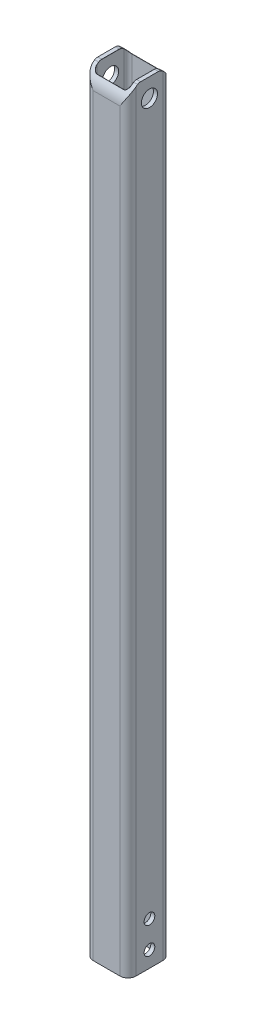
from build123d import *

# Parameters (mm, degrees)
TUBE_SQUARE_TS2X2X0_1875_1_DEPTH = 914.4
SKETCH2_R                        = 9.525
CUT_EXTRUDE1_DEPTH               = 917.162190881
FILLET1_R                        = 6.35
FILLET2_R                        = 0.127
SKETCH3_R                        = 6.35
CUT_EXTRUDE2_DEPTH               = 917.16219089


with BuildPart() as part:
    # Sketch1 → Tube (square) TS2X2X0.1875(1) (new body)
    with BuildSketch(Plane(origin=(0, 0, 0), x_dir=(1, 0, 0), z_dir=(0, 1, 0))):
        with BuildLine():
            Line((-15.875, -25.4), (15.875, -25.4))
            ThreePointArc((15.875, -25.4), (22.610192091, -22.610192091), (25.4, -15.875))
            Line((25.4, -15.875), (25.4, 15.875))
            ThreePointArc((25.4, 15.875), (22.610192091, 22.610192091), (15.875, 25.4))
            Line((15.875, 25.4), (-15.875, 25.4))
            ThreePointArc((-15.875, 25.4), (-22.610192091, 22.610192091), (-25.4, 15.875))
            Line((-25.4, 15.875), (-25.4, -15.875))
            ThreePointArc((-25.4, -15.875), (-22.610192091, -22.610192091), (-15.875, -25.4))
        make_face()
        with BuildLine():
            Line((-15.875, -20.6375), (15.875, -20.6375))
            ThreePointArc((15.875, -20.6375), (19.242596045, -19.242596045), (20.6375, -15.875))
            Line((20.6375, -15.875), (20.6375, 15.875))
            ThreePointArc((20.6375, 15.875), (19.242596045, 19.242596045), (15.875, 20.6375))
            Line((15.875, 20.6375), (-15.875, 20.6375))
            ThreePointArc((-15.875, 20.6375), (-19.242596045, 19.242596045), (-20.6375, 15.875))
            Line((-20.6375, 15.875), (-20.6375, -15.875))
            ThreePointArc((-20.6375, -15.875), (-19.242596045, -19.242596045), (-15.875, -20.6375))
        make_face(mode=Mode.SUBTRACT)
    extrude(amount=TUBE_SQUARE_TS2X2X0_1875_1_DEPTH)

    # Sketch2 → Cut-Extrude1 (cut, through all)
    with BuildSketch(Plane(origin=(25.4, 0, 0), x_dir=(0, 0, -1), z_dir=(1, 0, 0))):
        with Locations((0, 892.175)):
            Circle(SKETCH2_R)
        with BuildLine():
            Line((-25.4, 892.175), (-25.4, 931.2362217))
            Line((-25.4, 931.2362217), (25.4, 931.2362217))
            Line((25.4, 931.2362217), (25.4, 892.175))
            ThreePointArc((25.4, 892.175), (0, 917.575), (-25.4, 892.175))
        make_face()
    extrude(amount=-CUT_EXTRUDE1_DEPTH, mode=Mode.SUBTRACT)

    # Fillet1
    fillet1_edges = [part.edges().sort_by_distance(p)[0] for p in [
        (23.01875, 914.4, -12.296722124),
        (-23.01875, 914.4, -12.296722124),
        (-23.01875, 914.4, 12.296722124),
        (23.01875, 914.4, 12.296722124),
    ]]
    fillet(fillet1_edges, radius=FILLET1_R)

    # Fillet2
    fillet2_edges = [part.edges().sort_by_distance(p)[0] for p in [
        (-20.6375, 912.69278352, -14.972660399),
        (20.6375, 914.4, 0),
        (20.6375, 912.69278352, 14.972660399),
        (20.6375, 914.129662134, 12.363370814),
        (20.6375, 914.129662134, -12.363370814),
        (-20.6375, 914.4, 0),
        (-20.6375, 914.129662134, 12.363370814),
        (-20.6375, 914.129662134, -12.363370814),
        (19.435289435, 908.988907214, 19.038185958),
        (0, 906.982214247, 20.6375),
        (-19.435289435, 908.988907214, 19.038185958),
        (-20.6375, 912.69278352, 14.972660399),
        (-19.435289434, 908.988907215, -19.038185958),
        (0, 906.982214247, -20.6375),
        (19.435289435, 908.988907214, -19.038185958),
        (20.6375, 912.69278352, -14.972660399),
    ]]
    fillet(fillet2_edges, radius=FILLET2_R)

    # Sketch3 → Cut-Extrude2 (cut, through all)
    with BuildSketch(Plane(origin=(25.4, 0, 0), x_dir=(0, 0, -1), z_dir=(1, 0, 0))):
        with Locations((0, 50.8)):
            Circle(SKETCH3_R)
        with Locations((0, 19.05)):
            Circle(SKETCH3_R)
    extrude(amount=-CUT_EXTRUDE2_DEPTH, mode=Mode.SUBTRACT)


solid = part.part
